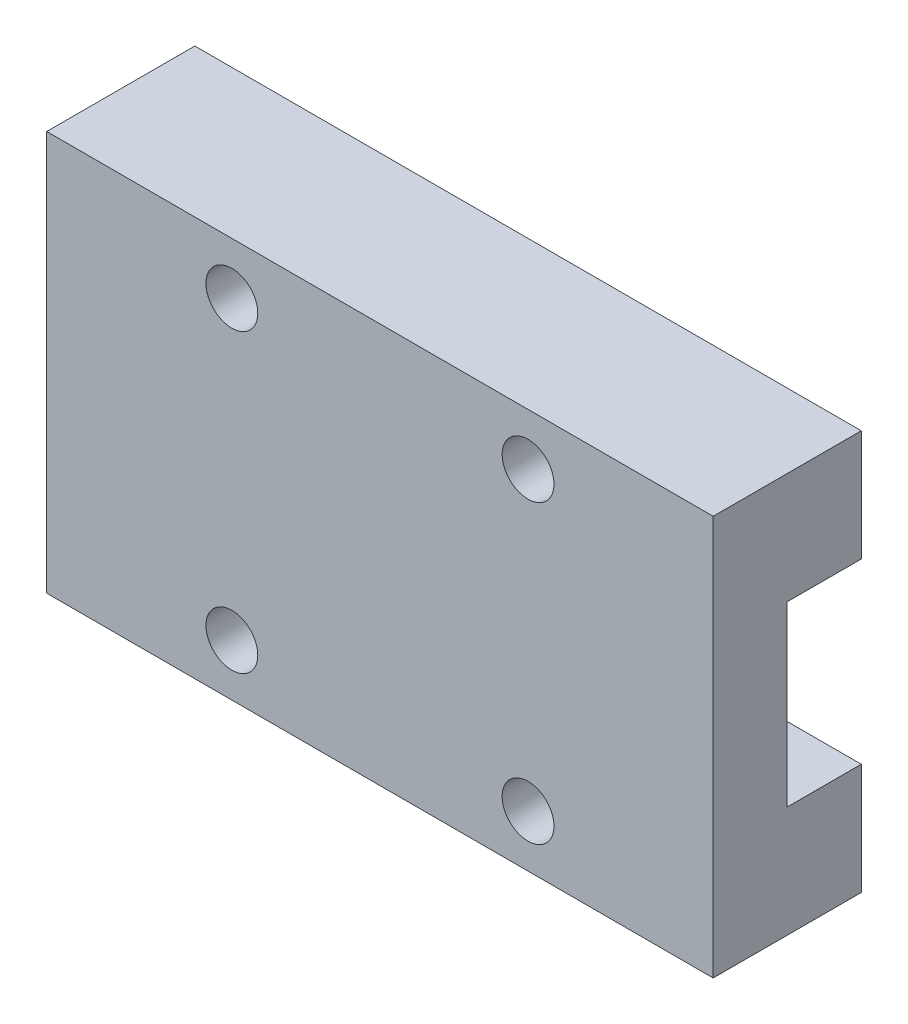
from build123d import *

# Parameters (mm, degrees)
BOSS_EXTRUDE1_DEPTH     = 22.5
SKETCH3_R               = 1.75
CUT_EXTRUDE1_DEPTH      = 8
MIRROR3_COPY_1_SKETCH_R = 1.75
MIRROR3_COPY_1_DEPTH    = 8


with BuildPart() as part:
    # Sketch1 → Boss-Extrude1 (new, symmetric)
    with BuildSketch(Plane(origin=(0, 0, 0), x_dir=(0, 0, -1), z_dir=(1, 0, 0))):
        Polygon((5, -6), (5, -13.5), (-5, -13.5), (-5, 13.5), (5, 13.5), (5, 6), (0, 6), (0, -6), align=None)
    extrude(amount=BOSS_EXTRUDE1_DEPTH, both=True)

    # Sketch3 → Cut-Extrude1 (cut)
    with BuildSketch(Plane.XY.offset(5)):
        with Locations((-10, 10)):
            Circle(SKETCH3_R)
    cut_extrude1 = extrude(amount=-CUT_EXTRUDE1_DEPTH, mode=Mode.SUBTRACT)

    # Mirror2: Cut-Extrude1 across plane
    add(cut_extrude1.mirror(Plane.ZX), mode=Mode.SUBTRACT)

    # Mirror3: Cut-Extrude1 across plane
    add(cut_extrude1.mirror(Plane(origin=(0, 0, 0), x_dir=(0, 0, 1), z_dir=(1, 0, 0))), mode=Mode.SUBTRACT)

    # Mirror3 copy 1 sketch → Mirror3 copy 1 (cut)
    with BuildSketch(Plane(origin=(0, 0, 5), x_dir=(-1, 0, 0), z_dir=(0, 0, 1))):
        with Locations((-10, 10)):
            Circle(MIRROR3_COPY_1_SKETCH_R)
    extrude(amount=-MIRROR3_COPY_1_DEPTH, mode=Mode.SUBTRACT)


solid = part.part
